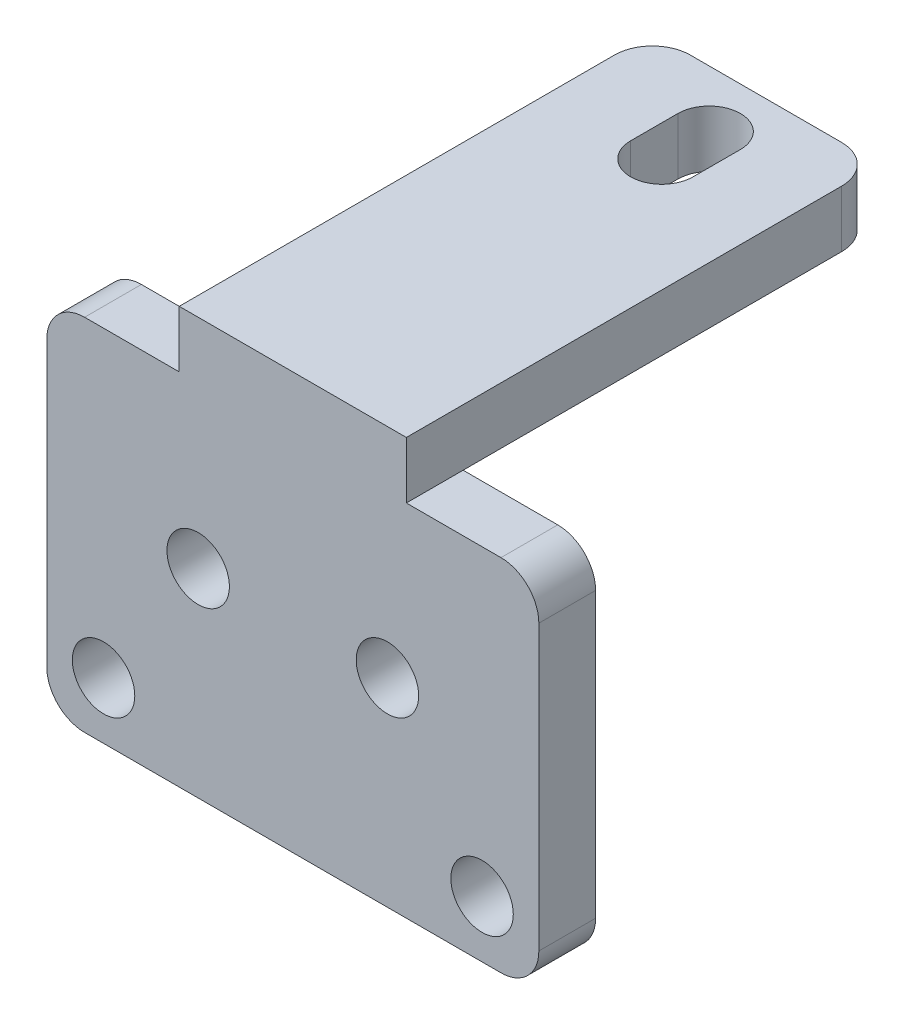
from build123d import *

# Parameters (mm, degrees)
SKETCH_1_R          = 1.65
EXTRUDE_1_DEPTH     = 3
SKETCH_2_W          = 12
SKETCH_2_H          = 3
EXTRUDE_2_DEPTH     = 22
CUT_EXTRUDE_2_DEPTH = 32
FILLET_1_R          = 2


with BuildPart() as part:
    # 草图1 → 凸台-拉伸1 (new body)
    with BuildSketch(Plane.XY):
        Polygon((-6, 16), (-13, 16), (-13, -3), (13, -3), (13, 16), (6, 16), (6, 19), (-6, 19), align=None)
        with Locations((-10, 0)):
            Circle(SKETCH_1_R, mode=Mode.SUBTRACT)
        with Locations((-5, 7.5)):
            Circle(SKETCH_1_R, mode=Mode.SUBTRACT)
        with Locations((10, 0)):
            Circle(SKETCH_1_R, mode=Mode.SUBTRACT)
        with Locations((5, 7.5)):
            Circle(SKETCH_1_R, mode=Mode.SUBTRACT)
    extrude(amount=EXTRUDE_1_DEPTH)

    # 草图2 → 凸台-拉伸2 (add)
    with BuildSketch(Plane(origin=(0, 0, 0), x_dir=(-1, 0, 0), z_dir=(0, 0, -1))):
        with Locations((0, 17.5)):
            Rectangle(SKETCH_2_W, SKETCH_2_H)
    extrude(amount=EXTRUDE_2_DEPTH)

    # 草图4 → 切除-拉伸2 (cut)
    with BuildSketch(Plane(origin=(0, 0, 0), x_dir=(1, 0, 0), z_dir=(0, 1, 0))):
        with BuildLine():
            Line((-1.65, 19), (-1.65, 16.5))
            ThreePointArc((-1.65, 16.5), (0, 14.85), (1.65, 16.5))
            Line((1.65, 16.5), (1.65, 19))
            ThreePointArc((1.65, 19), (0, 20.65), (-1.65, 19))
        make_face()
    extrude(amount=CUT_EXTRUDE_2_DEPTH, mode=Mode.SUBTRACT)

    # 圆角1
    fillet_1_edges = [part.edges().sort_by_distance(p)[0] for p in [
        (13, -3, 1.5),
        (-13, -3, 1.5),
        (-13, 16, 1.5),
        (13, 16, 1.5),
        (-6, 17.5, -22),
        (6, 17.5, -22),
    ]]
    fillet(fillet_1_edges, radius=FILLET_1_R)


solid = part.part
